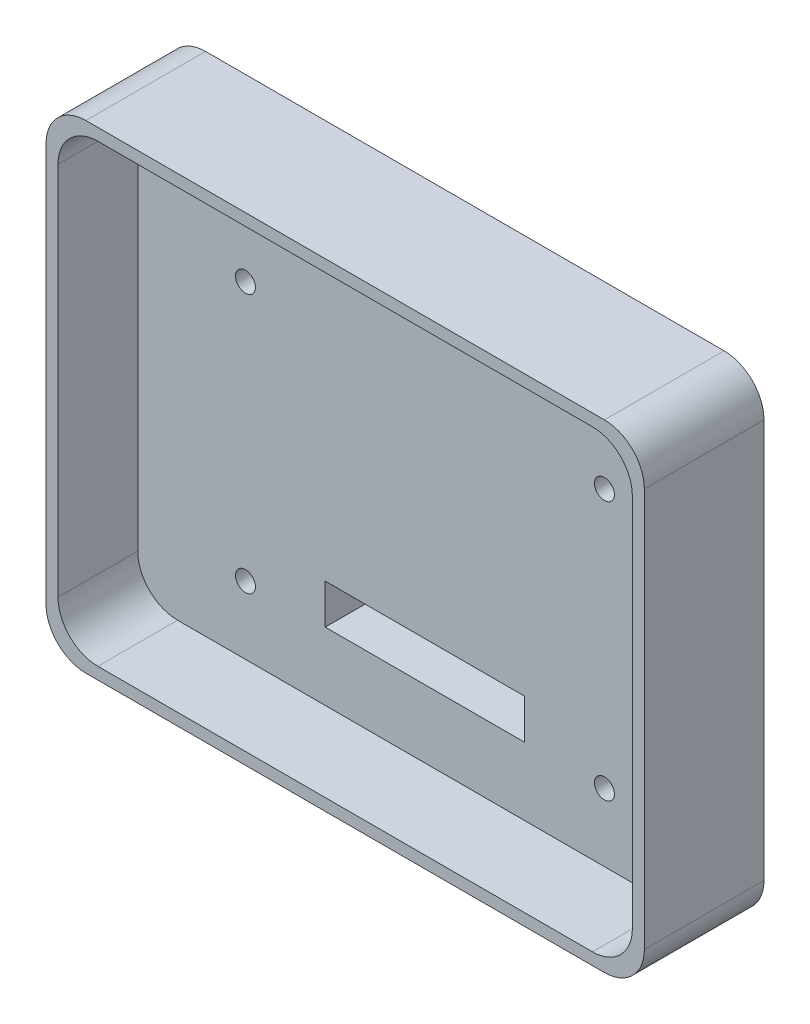
from build123d import *

# Parameters (mm, degrees)
SKETCH1_W                 = 150
SKETCH1_H                 = 120
BOSS_EXTRUDE1_DEPTH       = 30
SKETCH2_W                 = 25
SKETCH2_H                 = 105
CUT_EXTRUDE1_DEPTH        = 6.5
SKETCH4_W                 = 144
SKETCH4_H                 = 114
CUT_EXTRUDE2_DEPTH        = 20
FILLET1_R                 = 10
F_5_0MM_DOWEL_HOLE1_D     = 5
F_5_0MM_DOWEL_HOLE1_DEPTH = 20
F_5_0MM_DOWEL_HOLE1_TIP   = 1.502151548
SKETCH12_W                = 50
SKETCH12_H                = 10
CUT_EXTRUDE6_DEPTH        = 337.897861193


with BuildPart() as part:
    # Sketch1 → Boss-Extrude1 (new body)
    with BuildSketch(Plane.XY):
        with Locations((-249.668715257, 24.796192189)):
            Rectangle(SKETCH1_W, SKETCH1_H)
    extrude(amount=BOSS_EXTRUDE1_DEPTH)

    # Sketch2 → Cut-Extrude1 (cut)
    with BuildSketch(Plane(origin=(0, 0, 0), x_dir=(-1, 0, 0), z_dir=(0, 0, -1))):
        with Locations((204.668715257, 17.296192189)):
            Rectangle(SKETCH2_W, SKETCH2_H)
        with Locations((294.668715257, 17.296192189)):
            Rectangle(SKETCH2_W, SKETCH2_H)
    extrude(amount=-CUT_EXTRUDE1_DEPTH, mode=Mode.SUBTRACT)

    # Sketch4 → Cut-Extrude2 (cut)
    with BuildSketch(Plane.XY.offset(30)):
        with Locations((-249.668715257, 24.796192189)):
            Rectangle(SKETCH4_W, SKETCH4_H)
    extrude(amount=-CUT_EXTRUDE2_DEPTH, mode=Mode.SUBTRACT)

    # Fillet1
    fillet1_edges = [part.edges().sort_by_distance(p)[0] for p in [
        (-177.668715257, 81.796192189, 20),
        (-177.668715257, -32.203807811, 20),
        (-321.668715257, -32.203807811, 20),
        (-321.668715257, 81.796192189, 20),
        (-174.668715257, -35.203807811, 15),
        (-324.668715257, -35.203807811, 15),
        (-324.668715257, 84.796192189, 15),
        (-174.668715257, 84.796192189, 15),
    ]]
    fillet(fillet1_edges, radius=FILLET1_R)

    # Ø5.0mm Dowel Hole1
    with Locations(Plane(origin=(0, 0, 6.5), x_dir=(-1, 0, 0), z_dir=(0, 0, -1))):
        with Locations((204.668715257, 49.796192189), (204.668715257, -15.203807811), (294.668715257, 49.796192189), (294.668715257, -15.203807811)):
            Hole(F_5_0MM_DOWEL_HOLE1_D / 2, depth=F_5_0MM_DOWEL_HOLE1_DEPTH)
            with Locations((0, 0, -(F_5_0MM_DOWEL_HOLE1_DEPTH + F_5_0MM_DOWEL_HOLE1_TIP / 2))):  # 118° drill point
                Cone(0, F_5_0MM_DOWEL_HOLE1_D / 2, F_5_0MM_DOWEL_HOLE1_TIP, mode=Mode.SUBTRACT)

    # Sketch12 → Cut-Extrude6 (cut, through all)
    with BuildSketch(Plane(origin=(0, 0, 0), x_dir=(-1, 0, 0), z_dir=(0, 0, -1))):
        with Locations((249.668715257, -10.203807811)):
            Rectangle(SKETCH12_W, SKETCH12_H)
    extrude(amount=-CUT_EXTRUDE6_DEPTH, mode=Mode.SUBTRACT)


solid = part.part
